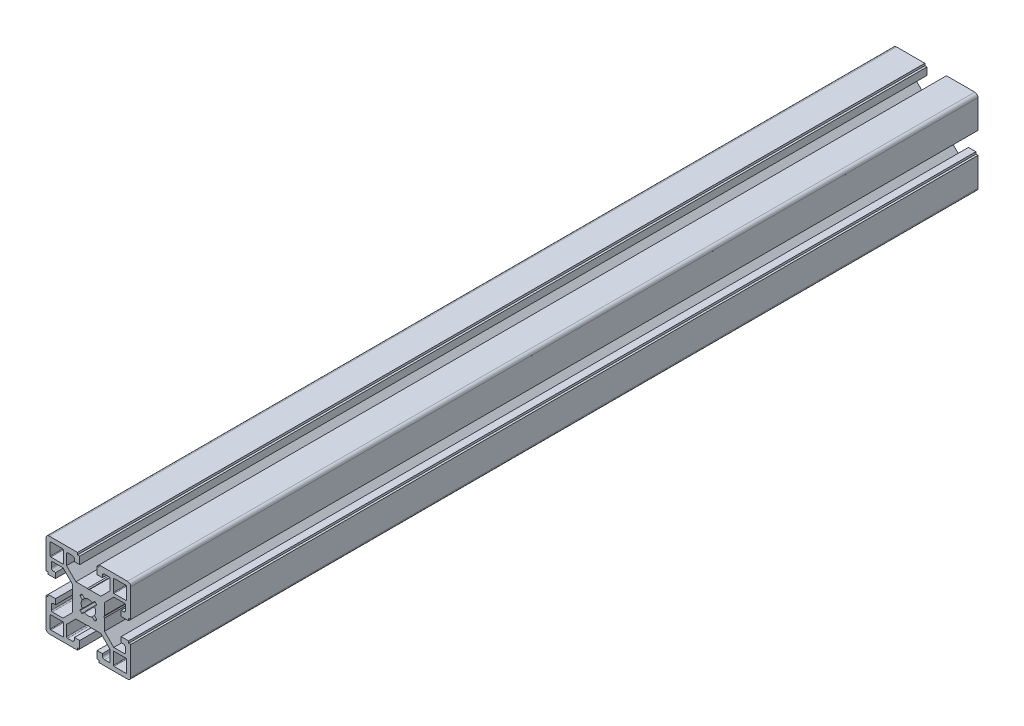
from build123d import *

# Parameters (mm, degrees)
EXTRUDE_1_DEPTH = 400


with BuildPart() as part:
    # 草图28 → 凸台-拉伸1 (new body)
    with BuildSketch(Plane.XY):
        with BuildLine():
            Line((-5.099341675, 20.0015), (-18.499341675, 20.0015))
            add(Edge.make_bspline(
                [(-18.499341675, 20.0015), (-19.999341675, 20.0015), (-19.999341675, 18.5015)],
                knots=[1.570796327, 1.570796327, 1.570796327, 3.141592654, 3.141592654, 3.141592654], degree=2, weights=[1, 0.707106781, 1]))
            Line((-19.999341675, 18.5015), (-19.999341675, 5.1015))
            Line((-19.999341675, 5.1015), (-18.999341675, 5.1015))
            Line((-18.999341675, 5.1015), (-18.999341675, 4.1015))
            Line((-18.999341675, 4.1015), (-15.499341675, 4.1015))
            Line((-15.499341675, 4.1015), (-15.499341675, 6.6015))
            Line((-15.499341675, 6.6015), (-16.499341675, 6.6015))
            add(Edge.make_bspline(
                [(-17.499341675, 7.6015), (-17.499341675, 6.6015), (-16.499341675, 6.6015)],
                knots=[0, 0, 0, 1.570796327, 1.570796327, 1.570796327], degree=2, weights=[1, 0.707106781, 1]))
            Line((-17.499341675, 7.6015), (-17.499341675, 9.8005))
            add(Edge.make_bspline(
                [(-16.999341675, 10.3005), (-17.499341675, 10.3005), (-17.499341675, 9.8005)],
                knots=[0, 0, 0, 1.570796327, 1.570796327, 1.570796327], degree=2, weights=[1, 0.707106781, 1]))
            Line((-16.999341675, 10.3005), (-11.996341675, 10.3005))
            Line((-11.996341675, 10.3005), (-7.599341675, 5.9035))
            Line((-7.599341675, 5.9035), (-7.599341675, 0.5195))
            Line((-7.599341675, 0.5195), (-7.299341675, 0.0005))
            Line((-7.299341675, 0.0005), (-7.599341675, -0.5185))
            Line((-7.599341675, -0.5185), (-7.599341675, -5.9015))
            Line((-7.599341675, -5.9015), (-11.996341675, -10.2985))
            Line((-11.996341675, -10.2985), (-16.999341675, -10.2985))
            add(Edge.make_bspline(
                [(-17.499341675, -9.7985), (-17.499341675, -10.2985), (-16.999341675, -10.2985)],
                knots=[0, 0, 0, 1.570796327, 1.570796327, 1.570796327], degree=2, weights=[1, 0.707106781, 1]))
            Line((-17.499341675, -9.7985), (-17.499341675, -7.5995))
            add(Edge.make_bspline(
                [(-16.499341675, -6.5995), (-17.499341675, -6.5995), (-17.499341675, -7.5995)],
                knots=[4.71238898, 4.71238898, 4.71238898, 6.283185307, 6.283185307, 6.283185307], degree=2, weights=[1, 0.707106781, 1]))
            Line((-16.499341675, -6.5995), (-15.499341675, -6.5995))
            Line((-15.499341675, -6.5995), (-15.499341675, -4.0995))
            Line((-15.499341675, -4.0995), (-18.999341675, -4.0995))
            Line((-18.999341675, -4.0995), (-18.999341675, -5.0995))
            Line((-18.999341675, -5.0995), (-19.999341675, -5.0995))
            Line((-19.999341675, -5.0995), (-19.999341675, -18.4985))
            add(Edge.make_bspline(
                [(-19.999341675, -18.4985), (-19.999341675, -19.9985), (-18.499341675, -19.9985)],
                knots=[1.570796327, 1.570796327, 1.570796327, 3.141592654, 3.141592654, 3.141592654], degree=2, weights=[1, 0.707106781, 1]))
            Line((-18.499341675, -19.9985), (-5.099341675, -19.9985))
            Line((-5.099341675, -19.9985), (-5.099341675, -18.9985))
            Line((-5.099341675, -18.9985), (-4.099341675, -18.9985))
            Line((-4.099341675, -18.9985), (-4.099341675, -15.4985))
            Line((-4.099341675, -15.4985), (-6.599341675, -15.4985))
            Line((-6.599341675, -15.4985), (-6.599341675, -16.4985))
            add(Edge.make_bspline(
                [(-7.599341675, -17.4985), (-6.599341675, -17.4985), (-6.599341675, -16.4985)],
                knots=[3.141592654, 3.141592654, 3.141592654, 4.71238898, 4.71238898, 4.71238898], degree=2, weights=[1, 0.707106781, 1]))
            Line((-7.599341675, -17.4985), (-9.799341675, -17.4985))
            add(Edge.make_bspline(
                [(-10.299341675, -16.9985), (-10.299341675, -17.4985), (-9.799341675, -17.4985)],
                knots=[4.71238898, 4.71238898, 4.71238898, 6.283185307, 6.283185307, 6.283185307], degree=2, weights=[1, 0.707106781, 1]))
            Line((-10.299341675, -16.9985), (-10.299341675, -11.9955))
            Line((-10.299341675, -11.9955), (-5.902341675, -7.5995))
            Line((-5.902341675, -7.5995), (-0.519341675, -7.5995))
            Line((-0.519341675, -7.5995), (0.000658325, -7.2995))
            Line((0.000658325, -7.2995), (0.519658325, -7.5995))
            Line((0.519658325, -7.5995), (5.903658325, -7.5995))
            Line((5.903658325, -7.5995), (10.300658325, -11.9955))
            Line((10.300658325, -11.9955), (10.300658325, -16.9985))
            add(Edge.make_bspline(
                [(9.800658325, -17.4985), (10.300658325, -17.4985), (10.300658325, -16.9985)],
                knots=[0, 0, 0, 1.570796327, 1.570796327, 1.570796327], degree=2, weights=[1, 0.707106781, 1]))
            Line((9.800658325, -17.4985), (7.600658325, -17.4985))
            add(Edge.make_bspline(
                [(6.600658325, -16.4985), (6.600658325, -17.4985), (7.600658325, -17.4985)],
                knots=[1.570796327, 1.570796327, 1.570796327, 3.141592654, 3.141592654, 3.141592654], degree=2, weights=[1, 0.707106781, 1]))
            Line((6.600658325, -16.4985), (6.600658325, -15.4985))
            Line((6.600658325, -15.4985), (4.100658325, -15.4985))
            Line((4.100658325, -15.4985), (4.100658325, -18.9985))
            Line((4.100658325, -18.9985), (5.100658325, -18.9985))
            Line((5.100658325, -18.9985), (5.100658325, -19.9985))
            Line((5.100658325, -19.9985), (18.500658325, -19.9985))
            add(Edge.make_bspline(
                [(18.500658325, -19.9985), (20.000658325, -19.9985), (20.000658325, -18.4985)],
                knots=[3.141592654, 3.141592654, 3.141592654, 4.71238898, 4.71238898, 4.71238898], degree=2, weights=[1, 0.707106781, 1]))
            Line((20.000658325, -18.4985), (20.000658325, -5.0995))
            Line((20.000658325, -5.0995), (19.000658325, -5.0995))
            Line((19.000658325, -5.0995), (19.000658325, -4.0995))
            Line((19.000658325, -4.0995), (15.500658325, -4.0995))
            Line((15.500658325, -4.0995), (15.500658325, -6.5995))
            Line((15.500658325, -6.5995), (16.500658325, -6.5995))
            add(Edge.make_bspline(
                [(17.500658325, -7.5995), (17.500658325, -6.5995), (16.500658325, -6.5995)],
                knots=[4.71238898, 4.71238898, 4.71238898, 6.283185307, 6.283185307, 6.283185307], degree=2, weights=[1, 0.707106781, 1]))
            Line((17.500658325, -7.5995), (17.500658325, -9.7985))
            add(Edge.make_bspline(
                [(17.000658325, -10.2985), (17.500658325, -10.2985), (17.500658325, -9.7985)],
                knots=[4.71238898, 4.71238898, 4.71238898, 6.283185307, 6.283185307, 6.283185307], degree=2, weights=[1, 0.707106781, 1]))
            Line((17.000658325, -10.2985), (11.997658325, -10.2985))
            Line((11.997658325, -10.2985), (7.600658325, -5.9015))
            Line((7.600658325, -5.9015), (7.600658325, -0.5185))
            Line((7.600658325, -0.5185), (7.300658325, 0.0005))
            Line((7.300658325, 0.0005), (7.600658325, 0.5195))
            Line((7.600658325, 0.5195), (7.600658325, 5.9035))
            Line((7.600658325, 5.9035), (11.997658325, 10.3005))
            Line((11.997658325, 10.3005), (17.000658325, 10.3005))
            add(Edge.make_bspline(
                [(17.500658325, 9.8005), (17.500658325, 10.3005), (17.000658325, 10.3005)],
                knots=[0, 0, 0, 1.570796327, 1.570796327, 1.570796327], degree=2, weights=[1, 0.707106781, 1]))
            Line((17.500658325, 9.8005), (17.500658325, 7.6015))
            add(Edge.make_bspline(
                [(16.500658325, 6.6015), (17.500658325, 6.6015), (17.500658325, 7.6015)],
                knots=[4.71238898, 4.71238898, 4.71238898, 6.283185307, 6.283185307, 6.283185307], degree=2, weights=[1, 0.707106781, 1]))
            Line((16.500658325, 6.6015), (15.500658325, 6.6015))
            Line((15.500658325, 6.6015), (15.500658325, 4.1015))
            Line((15.500658325, 4.1015), (19.000658325, 4.1015))
            Line((19.000658325, 4.1015), (19.000658325, 5.1015))
            Line((19.000658325, 5.1015), (20.000658325, 5.1015))
            Line((20.000658325, 5.1015), (20.000658325, 18.5015))
            add(Edge.make_bspline(
                [(20.000658325, 18.5015), (20.000658325, 20.0015), (18.500658325, 20.0015)],
                knots=[4.71238898, 4.71238898, 4.71238898, 6.283185307, 6.283185307, 6.283185307], degree=2, weights=[1, 0.707106781, 1]))
            Line((18.500658325, 20.0015), (5.100658325, 20.0015))
            Line((5.100658325, 20.0015), (5.100658325, 19.0015))
            Line((5.100658325, 19.0015), (4.100658325, 19.0015))
            Line((4.100658325, 19.0015), (4.100658325, 15.5015))
            Line((4.100658325, 15.5015), (6.600658325, 15.5015))
            Line((6.600658325, 15.5015), (6.600658325, 16.5015))
            add(Edge.make_bspline(
                [(7.600658325, 17.5015), (6.600658325, 17.5015), (6.600658325, 16.5015)],
                knots=[1.570796327, 1.570796327, 1.570796327, 3.141592654, 3.141592654, 3.141592654], degree=2, weights=[1, 0.707106781, 1]))
            Line((7.600658325, 17.5015), (9.800658325, 17.5015))
            add(Edge.make_bspline(
                [(10.300658325, 17.0015), (10.300658325, 17.5015), (9.800658325, 17.5015)],
                knots=[4.71238898, 4.71238898, 4.71238898, 6.283185307, 6.283185307, 6.283185307], degree=2, weights=[1, 0.707106781, 1]))
            Line((10.300658325, 17.0015), (10.300658325, 11.9985))
            Line((10.300658325, 11.9985), (5.903658325, 7.6015))
            Line((5.903658325, 7.6015), (0.519658325, 7.6015))
            Line((0.519658325, 7.6015), (0.000658325, 7.3005))
            Line((0.000658325, 7.3005), (-0.519341675, 7.6015))
            Line((-0.519341675, 7.6015), (-5.902341675, 7.6015))
            Line((-5.902341675, 7.6015), (-10.299341675, 11.9985))
            Line((-10.299341675, 11.9985), (-10.299341675, 17.0015))
            add(Edge.make_bspline(
                [(-9.799341675, 17.5015), (-10.299341675, 17.5015), (-10.299341675, 17.0015)],
                knots=[0, 0, 0, 1.570796327, 1.570796327, 1.570796327], degree=2, weights=[1, 0.707106781, 1]))
            Line((-9.799341675, 17.5015), (-7.599341675, 17.5015))
            add(Edge.make_bspline(
                [(-6.599341675, 16.5015), (-6.599341675, 17.5015), (-7.599341675, 17.5015)],
                knots=[3.141592654, 3.141592654, 3.141592654, 4.71238898, 4.71238898, 4.71238898], degree=2, weights=[1, 0.707106781, 1]))
            Line((-6.599341675, 16.5015), (-6.599341675, 15.5015))
            Line((-6.599341675, 15.5015), (-4.099341675, 15.5015))
            Line((-4.099341675, 15.5015), (-4.099341675, 19.0015))
            Line((-4.099341675, 19.0015), (-5.099341675, 19.0015))
            Line((-5.099341675, 19.0015), (-5.099341675, 20.0015))
        make_face()
        with BuildLine():
            Line((-2.875341675, -1.8145), (-3.853601586, -2.791759645))
            add(Edge.make_bspline(
                [(-3.853601586, -2.791759645), (-4.065949892, -3.003891465), (-3.853709961, -3.216131715)],
                knots=[5.497277142, 5.497277142, 5.497277142, 7.06858272, 7.06858272, 7.06858272], degree=2, weights=[1, 0.706926711, 1]))
            Line((-3.853709961, -3.216131715), (-3.21697339, -3.852868285))
            add(Edge.make_bspline(
                [(-3.21697339, -3.852868285), (-3.004950155, -4.06489045), (-2.792818712, -3.852976549)],
                knots=[2.356197015, 2.356197015, 2.356197015, 3.926477802, 3.926477802, 3.926477802], degree=2, weights=[1, 0.707289029, 1]))
            Line((-2.792818712, -3.852976549), (-1.814341675, -2.8755))
            ThreePointArc((-1.814341675, -2.8755), (0.000114762, -3.400267789), (1.814658325, -2.8755))
            Line((1.814658325, -2.8755), (2.794851817, -3.8526929))
            add(Edge.make_bspline(
                [(2.794851817, -3.8526929), (3.006983265, -4.064174884), (3.218790318, -3.852368007)],
                knots=[2.357727641, 2.357727641, 2.357727641, 3.926990403, 3.926990403, 3.926990403], degree=2, weights=[1, 0.70764877, 1]))
            Line((3.218790318, -3.852368007), (3.854528073, -3.216630251))
            add(Edge.make_bspline(
                [(3.854528073, -3.216630251), (4.066764123, -3.004391466), (3.854419956, -2.792260853)],
                knots=[5.497793587, 5.497793587, 5.497793587, 7.069086571, 7.069086571, 7.069086571], degree=2, weights=[1, 0.706931164, 1]))
            Line((3.854419956, -2.792260853), (2.875658325, -1.8145))
            ThreePointArc((2.875658325, -1.8145), (3.400267791, 0), (2.875658325, 1.8145))
            Line((2.875658325, 1.8145), (3.85363474, 2.793476391))
            add(Edge.make_bspline(
                [(3.85363474, 2.793476391), (4.065383626, 3.005441795), (3.853692944, 3.217465327)],
                knots=[0.785909163, 0.785909163, 0.785909163, 2.355408938, 2.355408938, 2.355408938], degree=2, weights=[1, 0.707565033, 1]))
            Line((3.853692944, 3.217465327), (3.217956723, 3.854201133))
            add(Edge.make_bspline(
                [(3.217956723, 3.854201133), (3.005933398, 4.066557825), (2.793634716, 3.854476415)],
                knots=[5.497001604, 5.497001604, 5.497001604, 7.068071494, 7.068071494, 7.068071494], degree=2, weights=[1, 0.707010056, 1]))
            Line((2.793634716, 3.854476415), (1.813922203, 2.87576463))
            ThreePointArc((1.813922203, 2.87576463), (-0.000247985, 3.400049397), (-1.814341675, 2.8755))
            Line((-1.814341675, 2.8755), (-2.792601431, 3.854760022))
            add(Edge.make_bspline(
                [(-2.792601431, 3.854760022), (-3.004899956, 4.067275428), (-3.217140188, 3.854701804)],
                knots=[5.49727661, 5.49727661, 5.49727661, 7.069368265, 7.069368265, 7.069368265], degree=2, weights=[1, 0.706648665, 1]))
            Line((-3.217140188, 3.854701804), (-3.853376294, 3.217465327))
            add(Edge.make_bspline(
                [(-3.853376294, 3.217465327), (-4.065066976, 3.005441795), (-3.853318091, 2.793476391)],
                knots=[3.927776369, 3.927776369, 3.927776369, 5.497276144, 5.497276144, 5.497276144], degree=2, weights=[1, 0.707565033, 1]))
            Line((-3.853318091, 2.793476391), (-2.875341675, 1.8145))
            ThreePointArc((-2.875341675, 1.8145), (-3.400267791, 1.44e-07), (-2.875341675, -1.8145))
        make_face(mode=Mode.SUBTRACT)
        with BuildLine():
            Line((-17.999341675, -12.0985), (-17.999341675, -17.6985))
            add(Edge.make_bspline(
                [(-17.999341675, -17.6985), (-17.999341675, -17.9985), (-17.699341675, -17.9985)],
                knots=[1.570796327, 1.570796327, 1.570796327, 3.141592654, 3.141592654, 3.141592654], degree=2, weights=[1, 0.707106781, 1]))
            Line((-17.699341675, -17.9985), (-12.099341675, -17.9985))
            add(Edge.make_bspline(
                [(-12.099341675, -17.9985), (-11.799341675, -17.9985), (-11.799341675, -17.6985)],
                knots=[3.141592654, 3.141592654, 3.141592654, 4.71238898, 4.71238898, 4.71238898], degree=2, weights=[1, 0.707106781, 1]))
            Line((-11.799341675, -17.6985), (-11.799341675, -12.0985))
            add(Edge.make_bspline(
                [(-11.799341675, -12.0985), (-11.799341675, -11.7985), (-12.099341675, -11.7985)],
                knots=[3.141592654, 3.141592654, 3.141592654, 4.71238898, 4.71238898, 4.71238898], degree=2, weights=[1, 0.707106781, 1]))
            Line((-12.099341675, -11.7985), (-17.699341675, -11.7985))
            add(Edge.make_bspline(
                [(-17.699341675, -11.7985), (-17.999341675, -11.7985), (-17.999341675, -12.0985)],
                knots=[4.71238898, 4.71238898, 4.71238898, 6.283185307, 6.283185307, 6.283185307], degree=2, weights=[1, 0.707106781, 1]))
        make_face(mode=Mode.SUBTRACT)
        with BuildLine():
            Line((-17.999341675, 17.7015), (-17.999341675, 12.1015))
            add(Edge.make_bspline(
                [(-17.999341675, 12.1015), (-17.999341671, 11.801553571), (-17.699395247, 11.80150001)],
                knots=[1.6e-08, 1.6e-08, 1.6e-08, 1.570617755, 1.570617755, 1.570617755], degree=2, weights=[1, 0.707169919, 1]))
            Line((-17.699395247, 11.80150001), (-12.09939358, 11.800500009))
            add(Edge.make_bspline(
                [(-12.09939358, 11.800500009), (-11.798338162, 11.800446249), (-11.799341675, 12.1015)],
                knots=[3.141414082, 3.141414082, 3.141414082, 4.715722305, 4.715722305, 4.715722305], degree=2, weights=[1, 0.705864049, 1]))
            Line((-11.799341675, 12.1015), (-11.799341675, 17.7015))
            add(Edge.make_bspline(
                [(-11.799341675, 17.7015), (-11.799341675, 18.0015), (-12.099341675, 18.0015)],
                knots=[3.141592654, 3.141592654, 3.141592654, 4.71238898, 4.71238898, 4.71238898], degree=2, weights=[1, 0.707106781, 1]))
            Line((-12.099341675, 18.0015), (-17.699341675, 18.0015))
            add(Edge.make_bspline(
                [(-17.699341675, 18.0015), (-17.999341675, 18.0015), (-17.999341675, 17.7015)],
                knots=[0, 0, 0, 1.570796327, 1.570796327, 1.570796327], degree=2, weights=[1, 0.707106781, 1]))
        make_face(mode=Mode.SUBTRACT)
        with BuildLine():
            Line((11.800658325, 17.7015), (11.800658325, 12.1015))
            add(Edge.make_bspline(
                [(11.800658325, 12.1015), (11.799654811, 11.800446249), (12.100710229, 11.800500009)],
                knots=[1.567463002, 1.567463002, 1.567463002, 3.141771225, 3.141771225, 3.141771225], degree=2, weights=[1, 0.705864049, 1]))
            Line((12.100710229, 11.800500009), (17.700711896, 11.80150001))
            add(Edge.make_bspline(
                [(17.700711896, 11.80150001), (18.00065832, 11.801553571), (18.000658325, 12.1015)],
                knots=[4.712567552, 4.712567552, 4.712567552, 6.283185291, 6.283185291, 6.283185291], degree=2, weights=[1, 0.707169919, 1]))
            Line((18.000658325, 12.1015), (18.000658325, 17.7015))
            add(Edge.make_bspline(
                [(18.000658325, 17.7015), (18.000658325, 18.0015), (17.700658325, 18.0015)],
                knots=[4.71238898, 4.71238898, 4.71238898, 6.283185307, 6.283185307, 6.283185307], degree=2, weights=[1, 0.707106781, 1]))
            Line((17.700658325, 18.0015), (12.100658325, 18.0015))
            add(Edge.make_bspline(
                [(12.100658325, 18.0015), (11.800658325, 18.0015), (11.800658325, 17.7015)],
                knots=[4.71238898, 4.71238898, 4.71238898, 6.283185307, 6.283185307, 6.283185307], degree=2, weights=[1, 0.707106781, 1]))
        make_face(mode=Mode.SUBTRACT)
        with BuildLine():
            Line((11.800658325, -12.0985), (11.800658325, -17.6985))
            add(Edge.make_bspline(
                [(11.800658325, -17.6985), (11.800658325, -17.9985), (12.100658325, -17.9985)],
                knots=[1.570796327, 1.570796327, 1.570796327, 3.141592654, 3.141592654, 3.141592654], degree=2, weights=[1, 0.707106781, 1]))
            Line((12.100658325, -17.9985), (17.700658325, -17.9985))
            add(Edge.make_bspline(
                [(17.700658325, -17.9985), (18.000658325, -17.9985), (18.000658325, -17.6985)],
                knots=[4.71238898, 4.71238898, 4.71238898, 6.283185307, 6.283185307, 6.283185307], degree=2, weights=[1, 0.707106781, 1]))
            Line((18.000658325, -17.6985), (18.000658325, -12.0985))
            add(Edge.make_bspline(
                [(18.000658325, -12.0985), (18.000658325, -11.7985), (17.700658325, -11.7985)],
                knots=[1.570796327, 1.570796327, 1.570796327, 3.141592654, 3.141592654, 3.141592654], degree=2, weights=[1, 0.707106781, 1]))
            Line((17.700658325, -11.7985), (12.100658325, -11.7985))
            add(Edge.make_bspline(
                [(12.100658325, -11.7985), (11.800658325, -11.7985), (11.800658325, -12.0985)],
                knots=[4.71238898, 4.71238898, 4.71238898, 6.283185307, 6.283185307, 6.283185307], degree=2, weights=[1, 0.707106781, 1]))
        make_face(mode=Mode.SUBTRACT)
    extrude(amount=EXTRUDE_1_DEPTH)


solid = part.part
